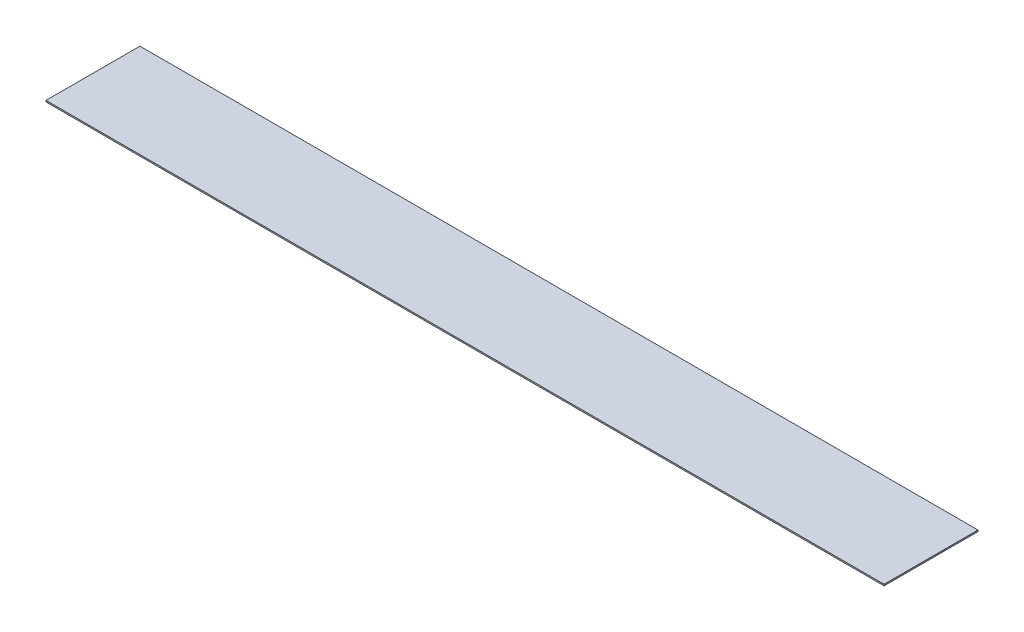
from build123d import *

# Parameters (mm, degrees)
SKETCH1_W           = 1785
SKETCH1_H           = 200
BOSS_EXTRUDE1_DEPTH = 3


with BuildPart() as part:
    # Sketch1 → Boss-Extrude1 (new body)
    with BuildSketch(Plane(origin=(0, 0, 0), x_dir=(1, 0, 0), z_dir=(0, 1, 0))):
        with Locations((892.5, 100)):
            Rectangle(SKETCH1_W, SKETCH1_H)
    extrude(amount=BOSS_EXTRUDE1_DEPTH)


solid = part.part
